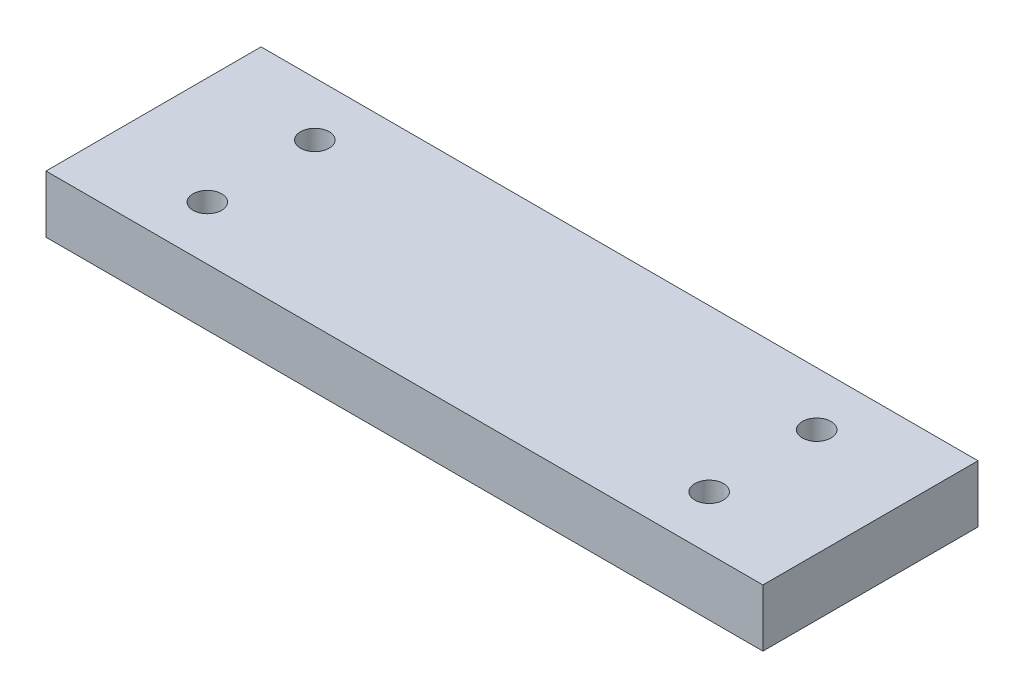
from build123d import *

# Parameters (mm, degrees)
SKETCH1_W           = 100
SKETCH1_H           = 30
SKETCH1_R           = 2
BOSS_EXTRUDE1_DEPTH = 8


with BuildPart() as part:
    # Sketch1 → Boss-Extrude1 (new body)
    with BuildSketch(Plane(origin=(0, 0, 0), x_dir=(1, 0, 0), z_dir=(0, 1, 0))):
        Rectangle(SKETCH1_W, SKETCH1_H)
        with Locations(Location((35, 7.5, 0), (0, 0, 270))):
            Circle(SKETCH1_R, mode=Mode.SUBTRACT)
        with Locations(Location((35, -7.5, 0), (0, 0, 270))):
            Circle(SKETCH1_R, mode=Mode.SUBTRACT)
        with Locations(Location((-35, -7.5, 0), (0, 0, 90))):
            Circle(SKETCH1_R, mode=Mode.SUBTRACT)
        with Locations(Location((-35, 7.5, 0), (0, 0, 90))):
            Circle(SKETCH1_R, mode=Mode.SUBTRACT)
    extrude(amount=BOSS_EXTRUDE1_DEPTH)


solid = part.part
